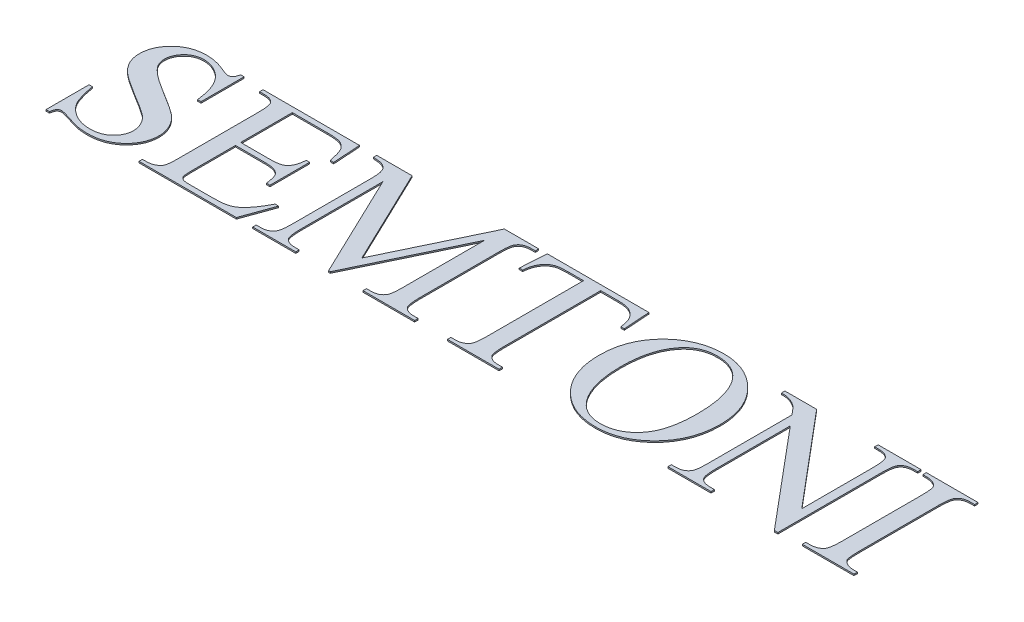
from build123d import *

# Parameters (mm, degrees)
EXTRUDE_2_DEPTH   = 0.1
EXTRUDE_2_2_DEPTH = 0.1
EXTRUDE_2_3_DEPTH = 0.1
EXTRUDE_2_4_DEPTH = 0.1
EXTRUDE_2_5_DEPTH = 0.1
EXTRUDE_2_6_DEPTH = 0.1
EXTRUDE_2_7_DEPTH = 0.1


with BuildPart() as part:
    # Эскиз1 → Бобышка-Вытянуть2 (new body)
    with BuildSketch(Plane(origin=(0, 32.573908465, 0), x_dir=(1, 0, 0), z_dir=(0, 1, 0))):
        with BuildLine():
            Line((-28.050617611, 5.102656502), (-28.050617611, 2.045134258))
            Line((-28.050617611, 2.045134258), (-28.295219391, 2.045134258))
            add(Edge.make_bspline(
                [(-28.295219391, 2.045134258), (-28.315072246, 2.193186959), (-28.352842992, 2.474862364), (-28.434734973, 2.87273566), (-28.5436898, 3.221718424), (-28.6722495, 3.528225629), (-28.826280316, 3.797611834), (-29.012890998, 4.032562752), (-29.225594637, 4.241855041), (-29.467776159, 4.414890244), (-29.724441158, 4.556068223), (-29.988818742, 4.66165999), (-30.260125688, 4.722434163), (-30.44220928, 4.731323955), (-30.532943483, 4.735753833)],
                knots=[0, 0, 0, 0, 1.391615872, 2.647597524, 3.779493633, 4.792580943, 5.739275105, 6.660626987, 7.579777993, 8.510505953, 9.424199044, 10.303693636, 11.154712373, 12, 12, 12, 12], degree=3))
            add(Edge.make_bspline(
                [(-30.532943483, 4.735753833), (-30.583356449, 4.735040593), (-30.682738029, 4.733634546), (-30.82772616, 4.71096895), (-30.966871673, 4.679217658), (-31.09937053, 4.632817072), (-31.22591802, 4.573902222), (-31.344388909, 4.500477354), (-31.457318381, 4.415715838), (-31.592790574, 4.285320886), (-31.741402966, 4.109072073), (-31.869597038, 3.873193629), (-31.95082373, 3.622476538), (-31.959754864, 3.449010854), (-31.964246084, 3.361779775)],
                knots=[0, 0, 0, 0, 0.822889295, 1.622202463, 2.392243957, 3.152657784, 3.911645477, 4.668560503, 5.426333872, 6.21417893, 7.737497937, 9.172141173, 10.577948251, 12, 12, 12, 12], degree=3))
            add(Edge.make_bspline(
                [(-31.964246084, 3.361779775), (-31.961691497, 3.294540872), (-31.956659869, 3.162104118), (-31.904633417, 2.969234766), (-31.82853046, 2.783346978), (-31.751170802, 2.672589626), (-31.712000498, 2.616508728)],
                knots=[0, 0, 0, 0, 1.005601748, 1.980678245, 2.977536257, 4, 4, 4, 4], degree=3))
            add(Edge.make_bspline(
                [(-31.712000498, 2.616508728), (-31.67705238, 2.57318598), (-31.601068055, 2.478993506), (-31.46111464, 2.340970337), (-31.293633446, 2.189263318), (-31.090883264, 2.032247148), (-30.859396889, 1.861495701), (-30.595891035, 1.680945156), (-30.301528121, 1.489768679), (-30.093110323, 1.362409987), (-29.984500431, 1.296041309)],
                knots=[0, 0, 0, 0, 0.611101905, 1.328659962, 2.156268474, 3.09294578, 4.144138902, 5.3166236, 6.60164907, 8, 8, 8, 8], degree=3))
            add(Edge.make_bspline(
                [(-29.984500431, 1.296041309), (-29.895262221, 1.241996862), (-29.722855498, 1.137583898), (-29.474786227, 0.985151514), (-29.247134635, 0.842177661), (-29.041096561, 0.707517158), (-28.853360885, 0.586235461), (-28.686760011, 0.472999532), (-28.540371186, 0.370249421), (-28.37232463, 0.249514225), (-28.187281559, 0.097873392), (-27.99200947, -0.099343548), (-27.827289855, -0.315745828), (-27.687927355, -0.544192037), (-27.575939263, -0.78282312), (-27.497884844, -1.029616344), (-27.447272476, -1.281673472), (-27.441838852, -1.452305051), (-27.439113163, -1.537899621)],
                knots=[0, 0, 0, 0, 1.248757792, 2.412579105, 3.485054527, 4.466330029, 5.358748662, 6.160222748, 6.877285666, 7.499507807, 8.636803392, 9.736681065, 10.813322086, 11.884251586, 12.9349048, 13.959676984, 14.976504968, 16, 16, 16, 16], degree=3))
            add(Edge.make_bspline(
                [(-27.439113163, -1.537899621), (-27.441071789, -1.618942799), (-27.444932489, -1.778689164), (-27.482865408, -2.013059829), (-27.542275134, -2.23841095), (-27.624587378, -2.456059426), (-27.732858889, -2.664866283), (-27.863068261, -2.86607272), (-28.016964278, -3.058513541), (-28.194005937, -3.237840104), (-28.387775077, -3.404547624), (-28.598117885, -3.549471444), (-28.822096666, -3.673166915), (-29.059016472, -3.774144557), (-29.30979746, -3.853357636), (-29.574225218, -3.908086402), (-29.852454944, -3.940867601), (-30.042375891, -3.94533152), (-30.139287494, -3.94760934)],
                knots=[0, 0, 0, 0, 0.963313627, 1.898813136, 2.815875059, 3.731934866, 4.660412485, 5.608226541, 6.578517028, 7.585790218, 8.601547949, 9.614560958, 10.618351627, 11.640082467, 12.672878095, 13.741299665, 14.847445351, 16, 16, 16, 16], degree=3))
            add(Edge.make_bspline(
                [(-30.139287494, -3.94760934), (-30.259883308, -3.944999113), (-30.494817955, -3.939914088), (-30.727408609, -3.906528846), (-30.840606659, -3.890280798)],
                knots=[0, 0, 0, 0, 1.026632861, 2, 2, 2, 2], degree=3))
            add(Edge.make_bspline(
                [(-30.840606659, -3.890280798), (-30.859086596, -3.886495712), (-30.900579371, -3.877997108), (-30.969582407, -3.862897034), (-31.051734378, -3.841640392), (-31.146933395, -3.814262375), (-31.255682898, -3.784642627), (-31.377030796, -3.747226347), (-31.511704656, -3.70603716), (-31.654682754, -3.659088542), (-31.796263651, -3.612388199), (-31.928986506, -3.572294531), (-32.047467399, -3.537889804), (-32.151670521, -3.508744106), (-32.242332549, -3.48768042), (-32.318762126, -3.472214637), (-32.381219454, -3.461909855), (-32.418391871, -3.459457798), (-32.434340129, -3.458405781)],
                knots=[0, 0, 0, 0, 0.547610857, 1.229543858, 2.050283417, 3.010418186, 4.10517149, 5.321963087, 6.696442991, 8.193455647, 9.690468303, 11.02416608, 12.217978543, 13.272156507, 14.164742802, 14.91905115, 15.53623542, 16, 16, 16, 16], degree=3))
            add(Edge.make_bspline(
                [(-32.434340129, -3.458405781), (-32.459272027, -3.45944333), (-32.507238553, -3.461439473), (-32.575985973, -3.478555312), (-32.63576191, -3.509670225), (-32.689486152, -3.553778409), (-32.731390884, -3.619605666), (-32.770726301, -3.705760335), (-32.798507099, -3.818616922), (-32.812679034, -3.902299885), (-32.820352312, -3.94760934)],
                knots=[0, 0, 0, 0, 0.858084681, 1.650870771, 2.416167262, 3.163326943, 4.015220049, 5.07550074, 6.416553863, 8, 8, 8, 8], degree=3))
            Line((-32.820352312, -3.94760934), (-33.064954091, -3.94760934))
            Line((-33.064954091, -3.94760934), (-33.064954091, -0.890087096))
            Line((-33.064954091, -0.890087096), (-32.820352312, -0.890087096))
            add(Edge.make_bspline(
                [(-32.820352312, -0.890087096), (-32.806915461, -0.972365308), (-32.780913101, -1.131586229), (-32.733711296, -1.361207004), (-32.688050313, -1.575514101), (-32.6329805, -1.772377301), (-32.578838587, -1.954655258), (-32.518786641, -2.120552316), (-32.459409287, -2.27245598), (-32.369567083, -2.450921869), (-32.237736589, -2.655204683), (-32.047656558, -2.879152893), (-31.818557469, -3.078651893), (-31.559223656, -3.254675055), (-31.27478661, -3.400054175), (-30.971570601, -3.503021993), (-30.655551105, -3.569187269), (-30.43963633, -3.576836255), (-30.330382635, -3.58070667)],
                knots=[0, 0, 0, 0, 0.983972942, 1.904138093, 2.767005898, 3.569583276, 4.316441937, 5.010894174, 5.651787391, 6.240252764, 7.366542846, 8.51322938, 9.695910635, 10.940957651, 12.205335424, 13.453715602, 14.711570431, 16, 16, 16, 16], degree=3))
            add(Edge.make_bspline(
                [(-30.330382635, -3.58070667), (-30.267920606, -3.578945189), (-30.1458913, -3.57550386), (-29.967292571, -3.557223027), (-29.798503454, -3.522543386), (-29.640188499, -3.474545251), (-29.491062242, -3.416386662), (-29.354511187, -3.339749766), (-29.226028926, -3.252878362), (-29.109869424, -3.150945092), (-29.006056051, -3.040680345), (-28.912831436, -2.926199203), (-28.836107539, -2.804553584), (-28.773178145, -2.678290608), (-28.722533314, -2.548068531), (-28.688486841, -2.412583913), (-28.666721566, -2.27240723), (-28.663670701, -2.176875961), (-28.66212206, -2.128383605)],
                knots=[0, 0, 0, 0, 1.21237399, 2.368561524, 3.478840252, 4.550321735, 5.576348489, 6.577655339, 7.582237555, 8.581099954, 9.56911946, 10.518897773, 11.44133683, 12.353448509, 13.253333502, 14.146743192, 15.059273559, 16, 16, 16, 16], degree=3))
            add(Edge.make_bspline(
                [(-28.66212206, -2.128383605), (-28.663836871, -2.073459814), (-28.667292977, -1.962763954), (-28.699876538, -1.796649813), (-28.75154628, -1.629997151), (-28.824733944, -1.463415336), (-28.918477755, -1.299244092), (-29.033426192, -1.138905616), (-29.174999456, -0.988087915), (-29.280503652, -0.894353779), (-29.334776954, -0.846135213)],
                knots=[0, 0, 0, 0, 0.880647729, 1.774896773, 2.706128403, 3.676651084, 4.688504397, 5.735483579, 6.835091053, 8, 8, 8, 8], degree=3))
            add(Edge.make_bspline(
                [(-29.334776954, -0.846135213), (-29.358183585, -0.827447775), (-29.412266722, -0.784268759), (-29.509034481, -0.716420244), (-29.628260535, -0.631909753), (-29.774738098, -0.536524867), (-29.946156581, -0.428718458), (-30.141617455, -0.305229147), (-30.362813128, -0.170839073), (-30.60183644, -0.025223308), (-30.8444789, 0.123263974), (-31.078989291, 0.265677037), (-31.29387277, 0.40468055), (-31.496023981, 0.531668096), (-31.680045573, 0.654759868), (-31.850620342, 0.766448855), (-32.003420743, 0.871719809), (-32.182938045, 0.999602852), (-32.382717201, 1.159089656), (-32.595920584, 1.359383699), (-32.774158249, 1.57368976), (-32.924935216, 1.795297357), (-33.044232455, 2.028960254), (-33.125374383, 2.275303517), (-33.177442516, 2.532163887), (-33.183954354, 2.707344902), (-33.187254981, 2.79613816)],
                knots=[0, 0, 0, 0, 0.389655712, 0.900334728, 1.537269357, 2.291310688, 3.174316797, 4.172404975, 5.299694727, 6.542110962, 7.814388237, 9.001405823, 10.111994972, 11.144392138, 12.107627027, 12.992692561, 13.797376976, 14.521960454, 15.860446118, 17.120896578, 18.321180878, 19.479817337, 20.602985803, 21.722201974, 22.845462189, 24, 24, 24, 24], degree=3))
            add(Edge.make_bspline(
                [(-33.187254981, 2.79613816), (-33.184945313, 2.873325191), (-33.180381646, 3.025838795), (-33.147249731, 3.250729829), (-33.092260632, 3.467503373), (-33.012634437, 3.675178236), (-32.912777526, 3.874867791), (-32.791616429, 4.067208659), (-32.647851881, 4.251236387), (-32.481635372, 4.423455034), (-32.300950957, 4.58348735), (-32.103478296, 4.721818727), (-31.896004845, 4.840595675), (-31.675548326, 4.937017911), (-31.443080113, 5.011523848), (-31.198714935, 5.064975497), (-30.94201726, 5.095436324), (-30.76743288, 5.100213929), (-30.67817579, 5.102656502)],
                knots=[0, 0, 0, 0, 0.974899241, 1.926300239, 2.865093898, 3.794703015, 4.730387505, 5.681482166, 6.661813011, 7.674920949, 8.701427092, 9.706126817, 10.715231942, 11.716962423, 12.739993052, 13.794382224, 14.872367468, 16, 16, 16, 16], degree=3))
            add(Edge.make_bspline(
                [(-30.67817579, 5.102656502), (-30.562641252, 5.098238363), (-30.326230253, 5.089197806), (-29.967215275, 5.02527135), (-29.598788816, 4.919624736), (-29.356235694, 4.820891044), (-29.231585578, 4.770150958)],
                knots=[0, 0, 0, 0, 0.927627064, 1.898144454, 2.919838524, 4, 4, 4, 4], degree=3))
            add(Edge.make_bspline(
                [(-29.231585578, 4.770150958), (-29.177167503, 4.746207949), (-29.077710533, 4.702448606), (-28.938219259, 4.656954138), (-28.826930654, 4.620847988), (-28.759759371, 4.615674442), (-28.730916311, 4.613452943)],
                knots=[0, 0, 0, 0, 1.351973675, 2.470929114, 3.343423542, 4, 4, 4, 4], degree=3))
            add(Edge.make_bspline(
                [(-28.730916311, 4.613452943), (-28.704661233, 4.614279014), (-28.653927879, 4.615875251), (-28.58204378, 4.63597138), (-28.517863422, 4.66684299), (-28.458810358, 4.710639885), (-28.408011144, 4.77592137), (-28.36287988, 4.862481893), (-28.325479063, 4.974375477), (-28.305931873, 5.057242653), (-28.295219391, 5.102656502)],
                knots=[0, 0, 0, 0, 0.869133882, 1.67944953, 2.454811455, 3.224387015, 4.096088506, 5.174323703, 6.45143945, 8, 8, 8, 8], degree=3))
            Line((-28.295219391, 5.102656502), (-28.050617611, 5.102656502))
        make_face()
    extrude(amount=EXTRUDE_2_DEPTH)


with BuildPart() as body_2:
    # Эскиз1 → Extrude 2 2 (new body)
    with BuildSketch(Plane(origin=(0, 32.573908465, 0), x_dir=(1, 0, 0), z_dir=(0, 1, 0))):
        with BuildLine():
            Line((-24.136989139, 4.613452943), (-24.136989139, 0.944426251))
            Line((-24.136989139, 0.944426251), (-22.057874013, 0.944426251))
            add(Edge.make_bspline(
                [(-22.057874013, 0.944426251), (-21.999260087, 0.945278026), (-21.887047037, 0.946908703), (-21.726267039, 0.955906493), (-21.580645664, 0.972571484), (-21.450502034, 0.997471272), (-21.335324608, 1.027599689), (-21.234990229, 1.06338729), (-21.148947172, 1.106389985), (-21.101856012, 1.144266584), (-21.079466895, 1.162274711)],
                knots=[0, 0, 0, 0, 1.378497325, 2.639055229, 3.785499939, 4.822596556, 5.752813006, 6.582149435, 7.325894273, 8, 8, 8, 8], degree=3))
            add(Edge.make_bspline(
                [(-21.079466895, 1.162274711), (-21.052528148, 1.187639259), (-20.997713443, 1.239250799), (-20.929248016, 1.332815633), (-20.869597018, 1.438666677), (-20.820668517, 1.558473086), (-20.777927543, 1.691108784), (-20.746669177, 1.837785873), (-20.723123072, 1.998000975), (-20.716181686, 2.109387019), (-20.712564226, 2.167435148)],
                knots=[0, 0, 0, 0, 0.807057727, 1.642193325, 2.520961646, 3.456744241, 4.464785926, 5.562353087, 6.729635801, 8, 8, 8, 8], degree=3))
            Line((-20.712564226, 2.167435148), (-20.467962446, 2.167435148))
            Line((-20.467962446, 2.167435148), (-20.467962446, -0.645485316))
            Line((-20.467962446, -0.645485316), (-20.712564226, -0.645485316))
            add(Edge.make_bspline(
                [(-20.712564226, -0.645485316), (-20.726553374, -0.554274682), (-20.751869753, -0.38920938), (-20.794522845, -0.16952314), (-20.837459261, -0.003140256), (-20.8748868, 0.086034785), (-20.890282706, 0.122717148)],
                knots=[0, 0, 0, 0, 1.400091839, 2.533767946, 3.396862008, 4, 4, 4, 4], degree=3))
            add(Edge.make_bspline(
                [(-20.890282706, 0.122717148), (-20.910566686, 0.157495374), (-20.951355973, 0.227431308), (-21.039569769, 0.315850844), (-21.142552107, 0.394594291), (-21.267537838, 0.46113234), (-21.417642622, 0.515242441), (-21.600926909, 0.551971324), (-21.817831135, 0.573824757), (-21.974370072, 0.576236868), (-22.057874013, 0.577523581)],
                knots=[0, 0, 0, 0, 0.730339962, 1.468649003, 2.255043961, 3.085373338, 4.035675664, 5.150343399, 6.479882613, 8, 8, 8, 8], degree=3))
            Line((-22.057874013, 0.577523581), (-24.136989139, 0.577523581))
            Line((-24.136989139, 0.577523581), (-24.136989139, -2.434135829))
            add(Edge.make_bspline(
                [(-24.136989139, -2.434135829), (-24.137389354, -2.481915911), (-24.138152587, -2.573035334), (-24.133036802, -2.702302511), (-24.130152692, -2.817028903), (-24.124343231, -2.916418053), (-24.117305958, -3.001297406), (-24.106936752, -3.071152224), (-24.099548934, -3.12748366), (-24.073579863, -3.20339379), (-24.010817514, -3.296075498), (-23.912241125, -3.3792311), (-23.800105634, -3.419262847), (-23.685275584, -3.443373956), (-23.539696994, -3.454692238), (-23.433127901, -3.457088139), (-23.37451953, -3.458405781)],
                knots=[0, 0, 0, 0, 1.288677705, 2.45758408, 3.489098831, 4.38406774, 5.143209633, 5.784735894, 6.290376563, 6.670724524, 7.93849931, 9.258749462, 10.069240206, 11.124103354, 12.418381796, 14, 14, 14, 14], degree=3))
            Line((-23.37451953, -3.458405781), (-21.80753938, -3.458405781))
            add(Edge.make_bspline(
                [(-21.80753938, -3.458405781), (-21.685863103, -3.456726665), (-21.460175486, -3.453612208), (-21.148551917, -3.436920792), (-20.890417057, -3.403294026), (-20.67574935, -3.35675083), (-20.490348481, -3.283504196), (-20.317268157, -3.185889299), (-20.146144902, -3.064132112), (-20.041921595, -2.96485069), (-19.988313644, -2.913784631)],
                knots=[0, 0, 0, 0, 1.488287981, 2.760506628, 3.813793052, 4.66981318, 5.439445504, 6.241513751, 7.095510901, 8, 8, 8, 8], degree=3))
            add(Edge.make_bspline(
                [(-19.988313644, -2.913784631), (-19.916009715, -2.834841387), (-19.7611117, -2.66571985), (-19.548582527, -2.366242674), (-19.330053208, -2.016058753), (-19.194238891, -1.759252294), (-19.122652659, -1.623892434)],
                knots=[0, 0, 0, 0, 0.823493647, 1.764185327, 2.821526682, 4, 4, 4, 4], degree=3))
            Line((-19.122652659, -1.623892434), (-18.87805088, -1.623892434))
            Line((-18.87805088, -1.623892434), (-19.671095712, -3.82530845))
            Line((-19.671095712, -3.82530845), (-26.583006934, -3.82530845))
            Line((-26.583006934, -3.82530845), (-26.583006934, -3.58070667))
            Line((-26.583006934, -3.58070667), (-26.281076613, -3.58070667))
            add(Edge.make_bspline(
                [(-26.281076613, -3.58070667), (-26.231252738, -3.578860603), (-26.131421821, -3.575161682), (-25.984311274, -3.545449958), (-25.840707726, -3.497924893), (-25.751190117, -3.451386331), (-25.705880241, -3.427830558)],
                knots=[0, 0, 0, 0, 0.993225946, 1.990103322, 2.982678719, 4, 4, 4, 4], degree=3))
            add(Edge.make_bspline(
                [(-25.705880241, -3.427830558), (-25.674346862, -3.409368214), (-25.611983321, -3.372855249), (-25.535883786, -3.296070306), (-25.472619013, -3.209189018), (-25.425543248, -3.100056697), (-25.394481534, -2.956601701), (-25.373514195, -2.765295141), (-25.361215603, -2.51901091), (-25.360430167, -2.336055208), (-25.359998037, -2.235396883)],
                knots=[0, 0, 0, 0, 0.66731377, 1.319745957, 1.964608581, 2.628644155, 3.481257446, 4.645895262, 6.154643106, 8, 8, 8, 8], degree=3))
            Line((-25.359998037, -2.235396883), (-25.359998037, 3.390444046))
            add(Edge.make_bspline(
                [(-25.359998037, 3.390444046), (-25.360196431, 3.45987851), (-25.360571519, 3.591153189), (-25.367800518, 3.777975495), (-25.381939317, 3.943520434), (-25.396364018, 4.088957754), (-25.423437788, 4.212022494), (-25.447499611, 4.316144493), (-25.481017177, 4.399643202), (-25.510949264, 4.444383467), (-25.524339857, 4.464398734)],
                knots=[0, 0, 0, 0, 1.515681782, 2.865589051, 4.07921189, 5.143357036, 6.051434242, 6.827115058, 7.475291317, 8, 8, 8, 8], degree=3))
            add(Edge.make_bspline(
                [(-25.524339857, 4.464398734), (-25.566313933, 4.506505005), (-25.65341433, 4.59387972), (-25.831642461, 4.678708003), (-26.044643126, 4.727205658), (-26.198596757, 4.732771801), (-26.281076613, 4.735753833)],
                knots=[0, 0, 0, 0, 0.855227083, 1.774681568, 2.807797254, 4, 4, 4, 4], degree=3))
            Line((-26.281076613, 4.735753833), (-26.583006934, 4.735753833))
            Line((-26.583006934, 4.735753833), (-26.583006934, 4.980355613))
            Line((-26.583006934, 4.980355613), (-19.734157108, 4.980355613))
            Line((-19.734157108, 4.980355613), (-19.611856218, 3.023541377))
            Line((-19.611856218, 3.023541377), (-19.856457998, 3.023541377))
            add(Edge.make_bspline(
                [(-19.856457998, 3.023541377), (-19.868406603, 3.084719862), (-19.891347266, 3.202179176), (-19.926808076, 3.370743472), (-19.96608817, 3.523876729), (-20.002478726, 3.662902937), (-20.043958294, 3.78595506), (-20.082700285, 3.895148908), (-20.124860149, 3.988759319), (-20.180821354, 4.094018599), (-20.261273272, 4.209528703), (-20.381044702, 4.327043305), (-20.518813325, 4.430687799), (-20.624266184, 4.480816833), (-20.678167101, 4.506439665)],
                knots=[0, 0, 0, 0, 1.262230624, 2.423413114, 3.48701335, 4.463268595, 5.332045682, 6.115542347, 6.808324797, 7.408465274, 8.528517928, 9.641194136, 10.794325741, 12, 12, 12, 12], degree=3))
            add(Edge.make_bspline(
                [(-20.678167101, 4.506439665), (-20.731304045, 4.523938374), (-20.852525015, 4.563858066), (-21.067449422, 4.58982509), (-21.331185851, 4.612478608), (-21.524626146, 4.613109732), (-21.629820899, 4.613452943)],
                knots=[0, 0, 0, 0, 0.696394265, 1.588679787, 2.688700125, 4, 4, 4, 4], degree=3))
            Line((-21.629820899, 4.613452943), (-24.136989139, 4.613452943))
        make_face()
    extrude(amount=EXTRUDE_2_2_DEPTH)


with BuildPart() as body_3:
    # Эскиз1 → Extrude 2 3 (new body)
    with BuildSketch(Plane(origin=(0, 32.573908465, 0), x_dir=(1, 0, 0), z_dir=(0, 1, 0))):
        with BuildLine():
            Line((-13.129909061, -3.82530845), (-16.676634864, 3.583450137))
            Line((-16.676634864, 3.583450137), (-16.676634864, -2.235396883))
            add(Edge.make_bspline(
                [(-16.676634864, -2.235396883), (-16.676725244, -2.302939022), (-16.676896732, -2.431095297), (-16.665953724, -2.61325749), (-16.654084518, -2.776021712), (-16.634372741, -2.918659052), (-16.613454808, -3.042707903), (-16.582288168, -3.145144648), (-16.549895776, -3.230267764), (-16.518825341, -3.275388335), (-16.504649238, -3.295974911)],
                knots=[0, 0, 0, 0, 1.48973486, 2.826663046, 4.025252461, 5.088590954, 6.003687083, 6.795186099, 7.45029523, 8, 8, 8, 8], degree=3))
            add(Edge.make_bspline(
                [(-16.504649238, -3.295974911), (-16.46142978, -3.339950208), (-16.37341732, -3.429501864), (-16.19670052, -3.519541734), (-15.988678068, -3.572848061), (-15.83873118, -3.577987069), (-15.759378191, -3.58070667)],
                knots=[0, 0, 0, 0, 0.893460505, 1.819450328, 2.846037184, 4, 4, 4, 4], degree=3))
            Line((-15.759378191, -3.58070667), (-15.453625966, -3.58070667))
            Line((-15.453625966, -3.58070667), (-15.453625966, -3.82530845))
            Line((-15.453625966, -3.82530845), (-18.51114821, -3.82530845))
            Line((-18.51114821, -3.82530845), (-18.51114821, -3.58070667))
            Line((-18.51114821, -3.58070667), (-18.205395986, -3.58070667))
            add(Edge.make_bspline(
                [(-18.205395986, -3.58070667), (-18.161369426, -3.579745591), (-18.07614376, -3.577885156), (-17.953483651, -3.559659539), (-17.840162101, -3.534360731), (-17.737047324, -3.494995135), (-17.643160717, -3.446093469), (-17.559796334, -3.384331647), (-17.488416997, -3.310219817), (-17.448044445, -3.255060222), (-17.427638765, -3.227180661)],
                knots=[0, 0, 0, 0, 1.182386838, 2.288838982, 3.326958154, 4.296765023, 5.246416275, 6.164047556, 7.072046332, 8, 8, 8, 8], degree=3))
            add(Edge.make_bspline(
                [(-17.427638765, -3.227180661), (-17.416248353, -3.206422112), (-17.391173339, -3.160723947), (-17.363423785, -3.079478119), (-17.341784096, -2.980528739), (-17.320339167, -2.865355247), (-17.305318577, -2.731917504), (-17.297500955, -2.581964142), (-17.288280787, -2.414492379), (-17.288188134, -2.297200687), (-17.288139313, -2.235396883)],
                knots=[0, 0, 0, 0, 0.561580455, 1.236271222, 2.028879402, 2.966584022, 4.017422664, 5.2149421, 6.532486222, 8, 8, 8, 8], degree=3))
            Line((-17.288139313, -2.235396883), (-17.288139313, 3.390444046))
            add(Edge.make_bspline(
                [(-17.288139313, 3.390444046), (-17.289101438, 3.485452938), (-17.290887619, 3.6618364), (-17.316042345, 3.904442663), (-17.351683467, 4.106593282), (-17.396144308, 4.221527813), (-17.416173057, 4.273303594)],
                knots=[0, 0, 0, 0, 1.269100049, 2.356076937, 3.259444487, 4, 4, 4, 4], degree=3))
            add(Edge.make_bspline(
                [(-17.416173057, 4.273303594), (-17.432955819, 4.305176685), (-17.467481854, 4.370747027), (-17.540833478, 4.458321684), (-17.634253884, 4.535984245), (-17.746423651, 4.608329174), (-17.888253885, 4.669109126), (-18.06470782, 4.708519307), (-18.276053832, 4.732735398), (-18.428896617, 4.734697785), (-18.51114821, 4.735753833)],
                knots=[0, 0, 0, 0, 0.685675889, 1.410594349, 2.160436148, 2.996293973, 3.94870651, 5.086176952, 6.431940446, 8, 8, 8, 8], degree=3))
            Line((-18.51114821, 4.735753833), (-18.51114821, 4.980355613))
            Line((-18.51114821, 4.980355613), (-16.00397997, 4.980355613))
            Line((-16.00397997, 4.980355613), (-12.728609267, -1.860850408))
            Line((-12.728609267, -1.860850408), (-9.453238563, 4.980355613))
            Line((-9.453238563, 4.980355613), (-7.014864573, 4.980355613))
            Line((-7.014864573, 4.980355613), (-7.014864573, 4.735753833))
            Line((-7.014864573, 4.735753833), (-7.314883943, 4.735753833))
            add(Edge.make_bspline(
                [(-7.314883943, 4.735753833), (-7.35955373, 4.734838179), (-7.445428485, 4.733077893), (-7.56927648, 4.714429607), (-7.683393909, 4.689756852), (-7.787019667, 4.649984481), (-7.881043953, 4.601248397), (-7.964302338, 4.538748926), (-8.037651578, 4.465946296), (-8.078075383, 4.410213701), (-8.098374018, 4.382227824)],
                knots=[0, 0, 0, 0, 1.192663738, 2.292818382, 3.341598875, 4.305885976, 5.250132179, 6.162540657, 7.077327887, 8, 8, 8, 8], degree=3))
            add(Edge.make_bspline(
                [(-8.098374018, 4.382227824), (-8.10976443, 4.361469275), (-8.134839445, 4.31577111), (-8.162588999, 4.234525281), (-8.184228688, 4.135575902), (-8.205673617, 4.02040241), (-8.220694207, 3.886964667), (-8.228511829, 3.737011305), (-8.237731997, 3.569539542), (-8.23782465, 3.45224785), (-8.237873471, 3.390444046)],
                knots=[0, 0, 0, 0, 0.561580455, 1.236271222, 2.028879402, 2.966584022, 4.017422664, 5.2149421, 6.532486222, 8, 8, 8, 8], degree=3))
            Line((-8.237873471, 3.390444046), (-8.237873471, -2.235396883))
            add(Edge.make_bspline(
                [(-8.237873471, -2.235396883), (-8.237954833, -2.302937143), (-8.238109213, -2.431089851), (-8.227280527, -2.613275873), (-8.215043213, -2.775963371), (-8.196460097, -2.918960383), (-8.172056316, -3.0424082), (-8.142225175, -3.145619377), (-8.107268258, -3.230457663), (-8.074945788, -3.275406346), (-8.06015499, -3.295974911)],
                knots=[0, 0, 0, 0, 1.486776415, 2.821049613, 4.017258766, 5.078485589, 5.994452933, 6.784380121, 7.443731031, 8, 8, 8, 8], degree=3))
            add(Edge.make_bspline(
                [(-8.06015499, -3.295974911), (-8.016972619, -3.340028578), (-7.928639489, -3.430144016), (-7.751188532, -3.518651856), (-7.543677759, -3.573202798), (-7.394275527, -3.578102822), (-7.314883943, -3.58070667)],
                knots=[0, 0, 0, 0, 0.893634595, 1.828003868, 2.845812335, 4, 4, 4, 4], degree=3))
            Line((-7.314883943, -3.58070667), (-7.014864573, -3.58070667))
            Line((-7.014864573, -3.58070667), (-7.014864573, -3.82530845))
            Line((-7.014864573, -3.82530845), (-10.683891266, -3.82530845))
            Line((-10.683891266, -3.82530845), (-10.683891266, -3.58070667))
            Line((-10.683891266, -3.58070667), (-10.378139042, -3.58070667))
            add(Edge.make_bspline(
                [(-10.378139042, -3.58070667), (-10.333477781, -3.579762946), (-10.247619414, -3.577948696), (-10.124272234, -3.559765959), (-10.010559315, -3.533865852), (-9.906785541, -3.495989527), (-9.81367138, -3.445467266), (-9.730676838, -3.384344845), (-9.659196073, -3.310727799), (-9.62005541, -3.255127494), (-9.600381821, -3.227180661)],
                knots=[0, 0, 0, 0, 1.198333024, 2.303717216, 3.340834392, 4.325725627, 5.259386468, 6.176132048, 7.08325442, 8, 8, 8, 8], degree=3))
            add(Edge.make_bspline(
                [(-9.600381821, -3.227180661), (-9.588991409, -3.206422112), (-9.563916394, -3.160723947), (-9.53616684, -3.079478119), (-9.514527151, -2.980528739), (-9.493082223, -2.865355247), (-9.478061632, -2.731917504), (-9.470244011, -2.581964142), (-9.461023842, -2.414492379), (-9.460931189, -2.297200687), (-9.460882368, -2.235396883)],
                knots=[0, 0, 0, 0, 0.561580455, 1.236271222, 2.028879402, 2.966584022, 4.017422664, 5.2149421, 6.532486222, 8, 8, 8, 8], degree=3))
            Line((-9.460882368, -2.235396883), (-9.460882368, 3.583450137))
            Line((-9.460882368, 3.583450137), (-13.007608171, -3.82530845))
            Line((-13.007608171, -3.82530845), (-13.129909061, -3.82530845))
        make_face()
    extrude(amount=EXTRUDE_2_3_DEPTH)


with BuildPart() as body_4:
    # Эскиз1 → Extrude 2 4 (new body)
    with BuildSketch(Plane(origin=(0, 32.573908465, 0), x_dir=(1, 0, 0), z_dir=(0, 1, 0))):
        with BuildLine():
            Line((0.812392371, 4.980355613), (0.934693261, 3.10953419))
            Line((0.934693261, 3.10953419), (0.690091481, 3.10953419))
            add(Edge.make_bspline(
                [(0.690091481, 3.10953419), (0.6776895, 3.193798708), (0.654750107, 3.349659032), (0.609119992, 3.562946945), (0.558971642, 3.739245394), (0.511017648, 3.838714926), (0.489441584, 3.883469508)],
                knots=[0, 0, 0, 0, 1.272003444, 2.352768082, 3.258856713, 4, 4, 4, 4], degree=3))
            add(Edge.make_bspline(
                [(0.489441584, 3.883469508), (0.453553143, 3.943247103), (0.383900177, 4.05926459), (0.252657322, 4.211123159), (0.104797137, 4.338483991), (-0.062966351, 4.44147234), (-0.252236056, 4.520987112), (-0.467244368, 4.575482142), (-0.709054083, 4.60713808), (-0.879336206, 4.611280888), (-0.968614336, 4.613452943)],
                knots=[0, 0, 0, 0, 0.969493434, 1.881611193, 2.781220507, 3.677324267, 4.611476311, 5.629159824, 6.756979455, 8, 8, 8, 8], degree=3))
            Line((-0.968614336, 4.613452943), (-2.245129873, 4.613452943))
            Line((-2.245129873, 4.613452943), (-2.245129873, -2.235396883))
            add(Edge.make_bspline(
                [(-2.245129873, -2.235396883), (-2.245220252, -2.302939022), (-2.245391741, -2.431095297), (-2.234448733, -2.61325749), (-2.222579527, -2.776021712), (-2.20286775, -2.918659052), (-2.181949817, -3.042707903), (-2.150783177, -3.145144648), (-2.118390784, -3.230267764), (-2.08732035, -3.275388335), (-2.073144246, -3.295974911)],
                knots=[0, 0, 0, 0, 1.48973486, 2.826663046, 4.025252461, 5.088590954, 6.003687083, 6.795186099, 7.45029523, 8, 8, 8, 8], degree=3))
            add(Edge.make_bspline(
                [(-2.073144246, -3.295974911), (-2.028580578, -3.339912381), (-1.938129553, -3.429092409), (-1.759983135, -3.519221554), (-1.551448691, -3.57290147), (-1.401496265, -3.578005553), (-1.322140345, -3.58070667)],
                knots=[0, 0, 0, 0, 0.902282073, 1.8313649, 2.852342462, 4, 4, 4, 4], degree=3))
            Line((-1.322140345, -3.58070667), (-1.022120975, -3.58070667))
            Line((-1.022120975, -3.58070667), (-1.022120975, -3.82530845))
            Line((-1.022120975, -3.82530845), (-4.691147668, -3.82530845))
            Line((-4.691147668, -3.82530845), (-4.691147668, -3.58070667))
            Line((-4.691147668, -3.58070667), (-4.385395443, -3.58070667))
            add(Edge.make_bspline(
                [(-4.385395443, -3.58070667), (-4.341368884, -3.579745591), (-4.256143218, -3.577885156), (-4.133483108, -3.559659539), (-4.020161558, -3.534360731), (-3.917046781, -3.494995135), (-3.823160175, -3.446093469), (-3.739795791, -3.384331647), (-3.668416455, -3.310219817), (-3.628043903, -3.255060222), (-3.607638223, -3.227180661)],
                knots=[0, 0, 0, 0, 1.182386838, 2.288838982, 3.326958154, 4.296765023, 5.246416275, 6.164047556, 7.072046332, 8, 8, 8, 8], degree=3))
            add(Edge.make_bspline(
                [(-3.607638223, -3.227180661), (-3.596247811, -3.206422112), (-3.571172796, -3.160723947), (-3.543423242, -3.079478119), (-3.521783553, -2.980528739), (-3.500338625, -2.865355247), (-3.485318034, -2.731917504), (-3.477500413, -2.581964142), (-3.468280244, -2.414492379), (-3.468187591, -2.297200687), (-3.46813877, -2.235396883)],
                knots=[0, 0, 0, 0, 0.561580455, 1.236271222, 2.028879402, 2.966584022, 4.017422664, 5.2149421, 6.532486222, 8, 8, 8, 8], degree=3))
            Line((-3.46813877, -2.235396883), (-3.46813877, 4.613452943))
            Line((-3.46813877, 4.613452943), (-4.532538701, 4.613452943))
            add(Edge.make_bspline(
                [(-4.532538701, 4.613452943), (-4.628138397, 4.612614632), (-4.804865934, 4.611064914), (-5.047811541, 4.593764867), (-5.247677242, 4.569403898), (-5.362787239, 4.536305448), (-5.413487298, 4.521727276)],
                knots=[0, 0, 0, 0, 1.290206054, 2.385101079, 3.288719717, 4, 4, 4, 4], degree=3))
            add(Edge.make_bspline(
                [(-5.413487298, 4.521727276), (-5.468622085, 4.498783799), (-5.58017226, 4.452363944), (-5.732308567, 4.345602085), (-5.872727006, 4.211945068), (-6.001099684, 4.051053918), (-6.11206036, 3.860415653), (-6.191744829, 3.635839167), (-6.254632863, 3.383830333), (-6.272000169, 3.203564003), (-6.281059235, 3.10953419)],
                knots=[0, 0, 0, 0, 0.8149513, 1.648831242, 2.524162633, 3.460481747, 4.455960915, 5.52585596, 6.709446718, 8, 8, 8, 8], degree=3))
            Line((-6.281059235, 3.10953419), (-6.525661014, 3.10953419))
            Line((-6.525661014, 3.10953419), (-6.403360124, 4.980355613))
            Line((-6.403360124, 4.980355613), (0.812392371, 4.980355613))
        make_face()
    extrude(amount=EXTRUDE_2_4_DEPTH)


with BuildPart() as body_5:
    # Эскиз1 → Extrude 2 5 (new body)
    with BuildSketch(Plane(origin=(0, 32.573908465, 0), x_dir=(1, 0, 0), z_dir=(0, 1, 0))):
        with BuildLine():
            add(Edge.make_bspline(
                [(6.033111603, 5.102656502), (6.172859477, 5.09946296), (6.448648147, 5.093160591), (6.854320762, 5.028622017), (7.246424101, 4.929971567), (7.625144613, 4.790355416), (7.987442895, 4.606208714), (8.337173033, 4.386164712), (8.670794153, 4.12364918), (8.986674345, 3.826296511), (9.278044767, 3.500148999), (9.534095066, 3.149388699), (9.747787261, 2.77685556), (9.926036999, 2.38665186), (10.061486415, 1.974939584), (10.158155411, 1.54360121), (10.219601925, 1.09269826), (10.226203955, 0.785380705), (10.229560883, 0.629119269)],
                knots=[0, 0, 0, 0, 0.98202372, 1.937997388, 2.881027266, 3.822118876, 4.769670076, 5.734044671, 6.723305605, 7.75005001, 8.781230837, 9.794598944, 10.798037779, 11.796394559, 12.806380977, 13.83982627, 14.901618723, 16, 16, 16, 16], degree=3))
            add(Edge.make_bspline(
                [(10.229560883, 0.629119269), (10.226191913, 0.467776815), (10.219589852, 0.151599164), (10.158766338, -0.312301793), (10.059236544, -0.753939745), (9.92417767, -1.17688033), (9.744852023, -1.57691094), (9.528396077, -1.957911855), (9.270439025, -2.316240751), (8.977628299, -2.650501774), (8.65773009, -2.953792447), (8.31757238, -3.219884872), (7.960382317, -3.444830064), (7.586640978, -3.629407493), (7.195568135, -3.771638733), (6.788232223, -3.872637838), (6.364383523, -3.935516771), (6.076007083, -3.943543253), (5.929920227, -3.94760934)],
                knots=[0, 0, 0, 0, 1.105289212, 2.165999938, 3.199623363, 4.204615257, 5.203215799, 6.19840424, 7.202665855, 8.223554404, 9.239475005, 10.219225154, 11.178454701, 12.127257531, 13.070460396, 14.024390953, 14.999188307, 16, 16, 16, 16], degree=3))
            add(Edge.make_bspline(
                [(5.929920227, -3.94760934), (5.781886844, -3.9445065), (5.490869561, -3.938406659), (5.065187099, -3.873422995), (4.656291729, -3.778366409), (4.26715946, -3.636439356), (3.893149245, -3.459008071), (3.540142378, -3.237076896), (3.202295327, -2.980123901), (2.890039215, -2.68274952), (2.603544148, -2.355410283), (2.352051781, -2.001302936), (2.140840798, -1.622249916), (1.968867191, -1.220323802), (1.831805422, -0.79657233), (1.73757788, -0.348209335), (1.6788612, 0.123060776), (1.671999677, 0.44549061), (1.6684986, 0.610009755)],
                knots=[0, 0, 0, 0, 1.016462961, 1.998253932, 2.952703386, 3.896991157, 4.838708659, 5.79220409, 6.756996177, 7.750938477, 8.749908999, 9.742163126, 10.729801125, 11.72586164, 12.741928676, 13.785044703, 14.869823709, 16, 16, 16, 16], degree=3))
            add(Edge.make_bspline(
                [(1.6684986, 0.610009755), (1.673061148, 0.77774515), (1.68201327, 1.106856711), (1.747756809, 1.589101084), (1.857638675, 2.04817454), (2.016365142, 2.482311296), (2.21494004, 2.893952766), (2.460279271, 3.280664676), (2.749311716, 3.644804882), (2.973096221, 3.862858251), (3.08642454, 3.973284224)],
                knots=[0, 0, 0, 0, 1.069821612, 2.099083859, 3.098457433, 4.075397538, 5.042245682, 6.008393354, 6.991416173, 8, 8, 8, 8], degree=3))
            add(Edge.make_bspline(
                [(3.08642454, 3.973284224), (3.189831842, 4.063943419), (3.39415374, 4.243076408), (3.727328013, 4.472431742), (4.074883549, 4.66666644), (4.437766635, 4.825817809), (4.815103043, 4.950833211), (5.208213653, 5.038117759), (5.615570217, 5.093586118), (5.892794348, 5.099608346), (6.033111603, 5.102656502)],
                knots=[0, 0, 0, 0, 1.020331703, 2.016067603, 2.996330227, 3.972568804, 4.953652495, 5.942660639, 6.958675748, 8, 8, 8, 8], degree=3))
        make_face()
        with BuildLine():
            add(Edge.make_bspline(
                [(5.910810713, 4.735753833), (5.815096506, 4.733459725), (5.627161581, 4.728955241), (5.35301115, 4.68541379), (5.093337341, 4.61705233), (4.847946032, 4.520911797), (4.617926105, 4.395868576), (4.402019855, 4.243787479), (4.201777202, 4.06282854), (4.083143005, 3.924948414), (4.022790727, 3.854805237)],
                knots=[0, 0, 0, 0, 1.063164563, 2.087524502, 3.076733094, 4.043076796, 5.009316746, 5.979698113, 6.972220307, 8, 8, 8, 8], degree=3))
            add(Edge.make_bspline(
                [(4.022790727, 3.854805237), (3.950981822, 3.759562391), (3.80526515, 3.566292902), (3.627137295, 3.240531774), (3.473254719, 2.8858249), (3.350414469, 2.497377442), (3.25290457, 2.07830564), (3.185873492, 1.627105367), (3.142644431, 1.145286257), (3.138329435, 0.813306612), (3.136109277, 0.642495929)],
                knots=[0, 0, 0, 0, 0.842079542, 1.708771735, 2.616192816, 3.571533622, 4.583868732, 5.654197247, 6.793033924, 8, 8, 8, 8], degree=3))
            add(Edge.make_bspline(
                [(3.136109277, 0.642495929), (3.139261441, 0.467251739), (3.145391802, 0.126435077), (3.186533449, -0.369829647), (3.259471461, -0.834436856), (3.357195774, -1.269007304), (3.487260771, -1.671968155), (3.646247961, -2.043279936), (3.829877798, -2.386696848), (3.980792515, -2.591187384), (4.055276901, -2.692114268)],
                knots=[0, 0, 0, 0, 1.194090181, 2.32227859, 3.389791915, 4.396332156, 5.354391058, 6.270237594, 7.146270854, 8, 8, 8, 8], degree=3))
            add(Edge.make_bspline(
                [(4.055276901, -2.692114268), (4.114843487, -2.763035576), (4.231596945, -2.90204485), (4.431106221, -3.082088457), (4.642724973, -3.237690815), (4.870429435, -3.3631515), (5.111899393, -3.462545818), (5.36772426, -3.52996754), (5.637288707, -3.574099886), (5.822088544, -3.578471995), (5.916543567, -3.58070667)],
                knots=[0, 0, 0, 0, 1.03798799, 2.034507832, 3.00651136, 3.978961382, 4.943739978, 5.928402204, 6.941163471, 8, 8, 8, 8], degree=3))
            add(Edge.make_bspline(
                [(5.916543567, -3.58070667), (6.017362295, -3.577869876), (6.215617715, -3.572291451), (6.506105274, -3.525235978), (6.782651849, -3.448253302), (7.047264606, -3.343414171), (7.295868947, -3.204355076), (7.532134947, -3.036272404), (7.752952661, -2.836129057), (7.962929027, -2.608543767), (8.153705483, -2.347035542), (8.317911421, -2.048960687), (8.454600318, -1.714869932), (8.569481568, -1.347481131), (8.655644585, -0.944300029), (8.718704312, -0.507043499), (8.753786156, -0.034554222), (8.759168116, 0.292099096), (8.761950205, 0.460955546)],
                knots=[0, 0, 0, 0, 0.868053581, 1.706987682, 2.527029803, 3.33706135, 4.152464395, 4.974651475, 5.829494242, 6.714957667, 7.637961825, 8.610582419, 9.638758338, 10.742501093, 11.922087167, 13.186154705, 14.545442825, 16, 16, 16, 16], degree=3))
            add(Edge.make_bspline(
                [(8.761950205, 0.460955546), (8.759784846, 0.644503171), (8.755598318, 0.999375983), (8.712129791, 1.513604756), (8.645619579, 1.992218846), (8.547949575, 2.434796386), (8.425495532, 2.842479286), (8.271001041, 3.212791111), (8.094951694, 3.551356919), (7.947335264, 3.750123406), (7.875268755, 3.847161431)],
                knots=[0, 0, 0, 0, 1.235800575, 2.389309172, 3.472797871, 4.487583422, 5.438786723, 6.335007093, 7.187148569, 8, 8, 8, 8], degree=3))
            add(Edge.make_bspline(
                [(7.875268755, 3.847161431), (7.815278499, 3.918322616), (7.696731032, 4.058945091), (7.489303712, 4.237776496), (7.268380949, 4.392734157), (7.029882405, 4.519676637), (6.773753742, 4.617749133), (6.500894239, 4.685226472), (6.211622426, 4.729272442), (6.012897608, 4.733554234), (5.910810713, 4.735753833)],
                knots=[0, 0, 0, 0, 0.998031887, 1.97222284, 2.930434429, 3.891254661, 4.86556567, 5.867574261, 6.904551903, 8, 8, 8, 8], degree=3))
        make_face(mode=Mode.SUBTRACT)
    extrude(amount=EXTRUDE_2_5_DEPTH)


with BuildPart() as body_6:
    # Эскиз1 → Extrude 2 6 (new body)
    with BuildSketch(Plane(origin=(0, 32.573908465, 0), x_dir=(1, 0, 0), z_dir=(0, 1, 0))):
        with BuildLine():
            Line((10.464607905, 4.980355613), (12.715708657, 4.980355613))
            Line((12.715708657, 4.980355613), (18.301419606, -1.660200511))
            Line((18.301419606, -1.660200511), (18.301419606, 3.390444046))
            add(Edge.make_bspline(
                [(18.301419606, 3.390444046), (18.301500969, 3.457984306), (18.301655349, 3.586137014), (18.290826663, 3.768323035), (18.278589349, 3.931010534), (18.260006233, 4.074007546), (18.235602451, 4.197455362), (18.205771311, 4.30066654), (18.170814394, 4.385504826), (18.138491924, 4.430453508), (18.123701126, 4.451022074)],
                knots=[0, 0, 0, 0, 1.486776415, 2.821049613, 4.017258766, 5.078485589, 5.994452933, 6.784380121, 7.443731031, 8, 8, 8, 8], degree=3))
            add(Edge.make_bspline(
                [(18.123701126, 4.451022074), (18.080481668, 4.494997371), (17.992469208, 4.584549027), (17.815752408, 4.674588897), (17.607729957, 4.727895223), (17.457783068, 4.733034232), (17.378430079, 4.735753833)],
                knots=[0, 0, 0, 0, 0.893460505, 1.819450328, 2.846037184, 4, 4, 4, 4], degree=3))
            Line((17.378430079, 4.735753833), (17.078410709, 4.735753833))
            Line((17.078410709, 4.735753833), (17.078410709, 4.980355613))
            Line((17.078410709, 4.980355613), (20.135932953, 4.980355613))
            Line((20.135932953, 4.980355613), (20.135932953, 4.735753833))
            Line((20.135932953, 4.735753833), (19.830180728, 4.735753833))
            add(Edge.make_bspline(
                [(19.830180728, 4.735753833), (19.786154169, 4.734792754), (19.700928503, 4.732932318), (19.578268393, 4.714706701), (19.464946843, 4.689407894), (19.361832066, 4.650042298), (19.26794546, 4.601140632), (19.184581076, 4.53937881), (19.11320174, 4.46526698), (19.072829188, 4.410107385), (19.052423508, 4.382227824)],
                knots=[0, 0, 0, 0, 1.182386838, 2.288838982, 3.326958154, 4.296765023, 5.246416275, 6.164047556, 7.072046332, 8, 8, 8, 8], degree=3))
            add(Edge.make_bspline(
                [(19.052423508, 4.382227824), (19.041033096, 4.361469275), (19.015958081, 4.31577111), (18.988208527, 4.234525281), (18.966568838, 4.135575902), (18.94512391, 4.02040241), (18.930103319, 3.886964667), (18.922285698, 3.737011305), (18.913065529, 3.569539542), (18.912972876, 3.45224785), (18.912924055, 3.390444046)],
                knots=[0, 0, 0, 0, 0.561580455, 1.236271222, 2.028879402, 2.966584022, 4.017422664, 5.2149421, 6.532486222, 8, 8, 8, 8], degree=3))
            Line((18.912924055, 3.390444046), (18.912924055, -3.966718854))
            Line((18.912924055, -3.966718854), (18.662589422, -3.966718854))
            Line((18.662589422, -3.966718854), (12.797879567, 3.027363279))
            Line((12.797879567, 3.027363279), (12.797879567, -2.235396883))
            add(Edge.make_bspline(
                [(12.797879567, -2.235396883), (12.797789188, -2.302939022), (12.797617699, -2.431095297), (12.808560707, -2.61325749), (12.820429914, -2.776021712), (12.84014169, -2.918659052), (12.861059623, -3.042707903), (12.892226263, -3.145144648), (12.924618656, -3.230267764), (12.95568909, -3.275388335), (12.969865194, -3.295974911)],
                knots=[0, 0, 0, 0, 1.48973486, 2.826663046, 4.025252461, 5.088590954, 6.003687083, 6.795186099, 7.45029523, 8, 8, 8, 8], degree=3))
            add(Edge.make_bspline(
                [(12.969865194, -3.295974911), (13.01373721, -3.339975226), (13.103131147, -3.429630585), (13.28066358, -3.518740258), (13.487656265, -3.573016477), (13.636395412, -3.578044756), (13.715136241, -3.58070667)],
                knots=[0, 0, 0, 0, 0.90104214, 1.835969978, 2.854386889, 4, 4, 4, 4], degree=3))
            Line((13.715136241, -3.58070667), (14.020888465, -3.58070667))
            Line((14.020888465, -3.58070667), (14.020888465, -3.82530845))
            Line((14.020888465, -3.82530845), (10.963366221, -3.82530845))
            Line((10.963366221, -3.82530845), (10.963366221, -3.58070667))
            Line((10.963366221, -3.58070667), (11.263385591, -3.58070667))
            add(Edge.make_bspline(
                [(11.263385591, -3.58070667), (11.308051135, -3.579780688), (11.393917734, -3.578000548), (11.517822401, -3.55949021), (11.632326551, -3.534209765), (11.736621645, -3.495936307), (11.829840868, -3.445554947), (11.912845222, -3.383783466), (11.986142802, -3.31087848), (12.026573546, -3.255159634), (12.046875666, -3.227180661)],
                knots=[0, 0, 0, 0, 1.192523296, 2.292548393, 3.341205387, 4.321321698, 5.250455988, 6.162757026, 7.077436536, 8, 8, 8, 8], degree=3))
            add(Edge.make_bspline(
                [(12.046875666, -3.227180661), (12.058266078, -3.206422112), (12.083341093, -3.160723947), (12.111090647, -3.079478119), (12.132730336, -2.980528739), (12.154175264, -2.865355247), (12.169195855, -2.731917504), (12.177013476, -2.581964142), (12.186233645, -2.414492379), (12.186326298, -2.297200687), (12.186375119, -2.235396883)],
                knots=[0, 0, 0, 0, 0.561580455, 1.236271222, 2.028879402, 2.966584022, 4.017422664, 5.2149421, 6.532486222, 8, 8, 8, 8], degree=3))
            Line((12.186375119, -2.235396883), (12.186375119, 3.757346715))
            add(Edge.make_bspline(
                [(12.186375119, 3.757346715), (12.127903228, 3.831248151), (12.020412574, 3.967103405), (11.862858999, 4.143805216), (11.732863703, 4.284330409), (11.614726039, 4.387193006), (11.495949447, 4.468314931), (11.3618054, 4.538983495), (11.206227051, 4.611173496), (11.09243697, 4.651389402), (11.032160472, 4.672692437)],
                knots=[0, 0, 0, 0, 1.504836603, 2.766386859, 3.781063438, 4.560215498, 5.262938925, 6.073352728, 6.979422906, 8, 8, 8, 8], degree=3))
            add(Edge.make_bspline(
                [(11.032160472, 4.672692437), (10.997264128, 4.682213838), (10.92001298, 4.703291668), (10.789485992, 4.723384269), (10.634861441, 4.733773449), (10.523864614, 4.735064561), (10.464607905, 4.735753833)],
                knots=[0, 0, 0, 0, 0.757017748, 1.675834294, 2.759222096, 4, 4, 4, 4], degree=3))
            Line((10.464607905, 4.735753833), (10.464607905, 4.980355613))
        make_face()
    extrude(amount=EXTRUDE_2_6_DEPTH)


with BuildPart() as body_7:
    # Эскиз1 → Extrude 2 7 (new body)
    with BuildSketch(Plane(origin=(0, 32.573908465, 0), x_dir=(1, 0, 0), z_dir=(0, 1, 0))):
        with BuildLine():
            Line((24.171862315, -3.58070667), (24.171862315, -3.82530845))
            Line((24.171862315, -3.82530845), (20.502835622, -3.82530845))
            Line((20.502835622, -3.82530845), (20.502835622, -3.58070667))
            Line((20.502835622, -3.58070667), (20.804765944, -3.58070667))
            add(Edge.make_bspline(
                [(20.804765944, -3.58070667), (20.887454925, -3.577182136), (21.043311342, -3.570538913), (21.259055444, -3.507743062), (21.443725694, -3.407671053), (21.531570744, -3.305979856), (21.574879359, -3.255844932)],
                knots=[0, 0, 0, 0, 1.142072474, 2.152636554, 3.089228675, 4, 4, 4, 4], degree=3))
            add(Edge.make_bspline(
                [(21.574879359, -3.255844932), (21.58768929, -3.235181414), (21.615618757, -3.190128787), (21.644982081, -3.107612986), (21.668986067, -3.007564764), (21.689506635, -2.888771484), (21.706797805, -2.751730818), (21.717157455, -2.596049615), (21.72550592, -2.422123213), (21.725727834, -2.29974498), (21.72584452, -2.235396883)],
                knots=[0, 0, 0, 0, 0.558477324, 1.217647012, 2.003767936, 2.927281204, 3.991475019, 5.182702724, 6.518627757, 8, 8, 8, 8], degree=3))
            Line((21.72584452, -2.235396883), (21.72584452, 3.390444046))
            add(Edge.make_bspline(
                [(21.72584452, 3.390444046), (21.725383689, 3.444591212), (21.724499869, 3.548439258), (21.720439691, 3.697497197), (21.715680215, 3.832662723), (21.705758812, 3.953053044), (21.694493419, 4.058220524), (21.681808521, 4.149004895), (21.664924744, 4.225644362), (21.650337433, 4.271476102), (21.643673609, 4.292413108)],
                knots=[0, 0, 0, 0, 1.429813016, 2.742217149, 3.937514499, 5.000517028, 5.931114638, 6.730382289, 7.42000908, 8, 8, 8, 8], degree=3))
            add(Edge.make_bspline(
                [(21.643673609, 4.292413108), (21.631363808, 4.319792501), (21.606522889, 4.375043542), (21.547726587, 4.448941659), (21.474962731, 4.518637774), (21.416355652, 4.557049598), (21.38569517, 4.577144867)],
                knots=[0, 0, 0, 0, 0.918337523, 1.853185807, 2.876887247, 4, 4, 4, 4], degree=3))
            add(Edge.make_bspline(
                [(21.38569517, 4.577144867), (21.339758272, 4.601353437), (21.249021844, 4.64917119), (21.104088324, 4.698118637), (20.955930658, 4.7308765), (20.855263332, 4.734124534), (20.804765944, 4.735753833)],
                knots=[0, 0, 0, 0, 1.021974771, 2.018646118, 3.0061006, 4, 4, 4, 4], degree=3))
            Line((20.804765944, 4.735753833), (20.502835622, 4.735753833))
            Line((20.502835622, 4.735753833), (20.502835622, 4.980355613))
            Line((20.502835622, 4.980355613), (24.171862315, 4.980355613))
            Line((24.171862315, 4.980355613), (24.171862315, 4.735753833))
            Line((24.171862315, 4.735753833), (23.864199139, 4.735753833))
            add(Edge.make_bspline(
                [(23.864199139, 4.735753833), (23.782895087, 4.73192921), (23.62992701, 4.72473344), (23.416232291, 4.665807293), (23.236767399, 4.56109458), (23.149049964, 4.460684721), (23.105551432, 4.410892095)],
                knots=[0, 0, 0, 0, 1.13807004, 2.141201847, 3.078233522, 4, 4, 4, 4], degree=3))
            add(Edge.make_bspline(
                [(23.105551432, 4.410892095), (23.092855085, 4.390179553), (23.065051353, 4.344821159), (23.033348814, 4.262879796), (23.007136371, 4.162875476), (22.987149349, 4.043793415), (22.970355372, 3.90669009), (22.956769447, 3.751207578), (22.94942024, 3.577152703), (22.949048751, 3.454786052), (22.948853417, 3.390444046)],
                knots=[0, 0, 0, 0, 0.557764716, 1.221448966, 2.010247393, 2.932582272, 3.995418194, 5.186297549, 6.520517964, 8, 8, 8, 8], degree=3))
            Line((22.948853417, 3.390444046), (22.948853417, -2.235396883))
            add(Edge.make_bspline(
                [(22.948853417, -2.235396883), (22.9493111, -2.289544322), (22.950188883, -2.39339289), (22.954290269, -2.542447264), (22.958892553, -2.676989773), (22.969193427, -2.797344345), (22.980050867, -2.902552742), (22.992903327, -2.993956287), (23.009770531, -3.070597475), (23.02435967, -3.116429026), (23.031024328, -3.137365945)],
                knots=[0, 0, 0, 0, 1.429820858, 2.742232189, 3.937536094, 4.983777767, 5.931103291, 6.730375326, 7.420005899, 8, 8, 8, 8], degree=3))
            add(Edge.make_bspline(
                [(23.031024328, -3.137365945), (23.043231652, -3.164821454), (23.068025187, -3.220584626), (23.12914062, -3.293854634), (23.203626245, -3.363622052), (23.263439187, -3.402011085), (23.294735621, -3.422097704)],
                knots=[0, 0, 0, 0, 0.908719256, 1.845642983, 2.872757476, 4, 4, 4, 4], degree=3))
            add(Edge.make_bspline(
                [(23.294735621, -3.422097704), (23.340051008, -3.446239812), (23.428989312, -3.493622351), (23.571084705, -3.543429104), (23.716233469, -3.575629283), (23.814984355, -3.579017883), (23.864199139, -3.58070667)],
                knots=[0, 0, 0, 0, 1.029331028, 2.020217884, 3.01332988, 4, 4, 4, 4], degree=3))
            Line((23.864199139, -3.58070667), (24.171862315, -3.58070667))
        make_face()
    extrude(amount=EXTRUDE_2_7_DEPTH)


solid = Compound([part.part, body_2.part, body_3.part, body_4.part, body_5.part, body_6.part, body_7.part])
